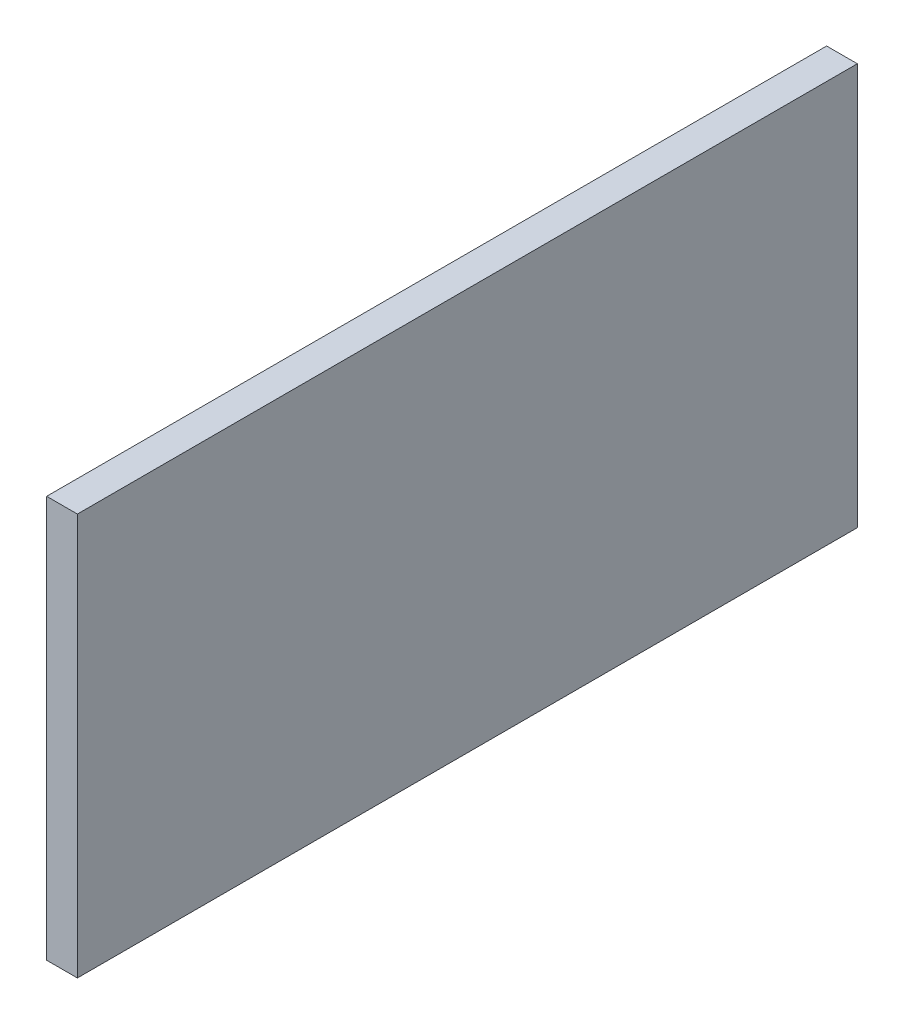
from build123d import *

# Parameters (mm, degrees)
SKETCH1_W           = 33
SKETCH1_H           = 17
BOSS_EXTRUDE1_DEPTH = 1.3


with BuildPart() as part:
    # Sketch1 → Boss-Extrude1 (new body)
    with BuildSketch(Plane(origin=(0, 0, 0), x_dir=(0, 0, -1), z_dir=(1, 0, 0))):
        Rectangle(SKETCH1_W, SKETCH1_H)
    extrude(amount=BOSS_EXTRUDE1_DEPTH)


solid = part.part
